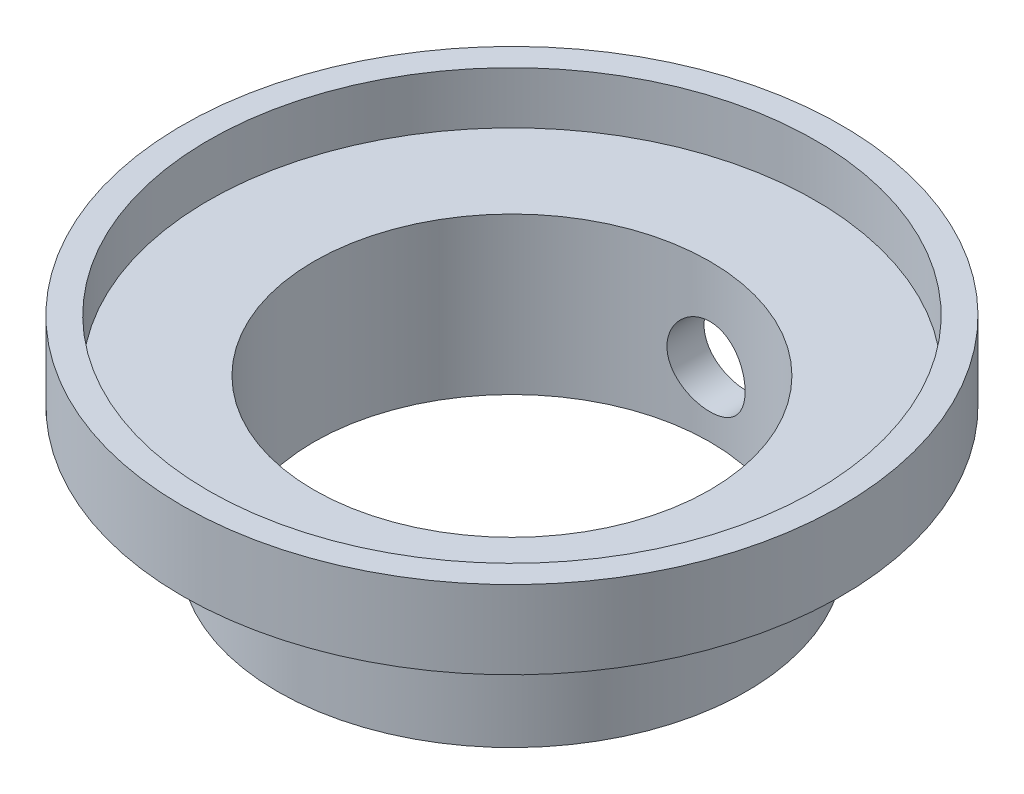
from build123d import *

# Parameters (mm, degrees)
ESQUISSE1_R             = 9
ESQUISSE1_R_2           = 7.6
BOSS_EXTRU_1_DEPTH      = 5
ESQUISSE2_R             = 12.65
ESQUISSE2_R_2           = 7.6
BOSS_EXTRU_2_DEPTH      = 3
ESQUISSE3_R             = 11.65
ENL_V_MAT_EXTRU_1_DEPTH = 2
ESQUISSE4_R             = 1.5
ENL_V_MAT_EXTRU_2_DEPTH = 12


with BuildPart() as part:
    # Esquisse1 → Boss.-Extru.1 (new body)
    with BuildSketch(Plane(origin=(0, 0, 0), x_dir=(1, 0, 0), z_dir=(0, 1, 0))):
        with Locations(Location((0, 0, 0), (0, 0, 270))):
            Circle(ESQUISSE1_R)
        with Locations(Location((0, 0, 0), (0, 0, 270))):
            Circle(ESQUISSE1_R_2, mode=Mode.SUBTRACT)
    extrude(amount=BOSS_EXTRU_1_DEPTH)

    # Esquisse2 → Boss.-Extru.2 (add)
    with BuildSketch(Plane(origin=(0, 5, 0), x_dir=(1, 0, 0), z_dir=(0, 1, 0))):
        with Locations(Location((0, 0, 0), (0, 0, 270))):
            Circle(ESQUISSE2_R)
        with Locations(Location((0, 0, 0), (0, 0, 270))):
            Circle(ESQUISSE2_R_2, mode=Mode.SUBTRACT)
    extrude(amount=BOSS_EXTRU_2_DEPTH)

    # Esquisse3 → Enlèv. mat.-Extru.1 (cut)
    with BuildSketch(Plane(origin=(0, 8, 0), x_dir=(1, 0, 0), z_dir=(0, 1, 0))):
        with Locations(Location((0, 0, 0), (0, 0, 270))):
            Circle(ESQUISSE3_R)
    extrude(amount=-ENL_V_MAT_EXTRU_1_DEPTH, mode=Mode.SUBTRACT)

    # Esquisse4 → Enlèv. mat.-Extru.2 (cut)
    with BuildSketch(Plane.XY):
        with Locations(Location((0, 2.5, 0), (0, 0, 90))):
            Circle(ESQUISSE4_R)
    extrude(amount=-ENL_V_MAT_EXTRU_2_DEPTH, mode=Mode.SUBTRACT)


solid = part.part
